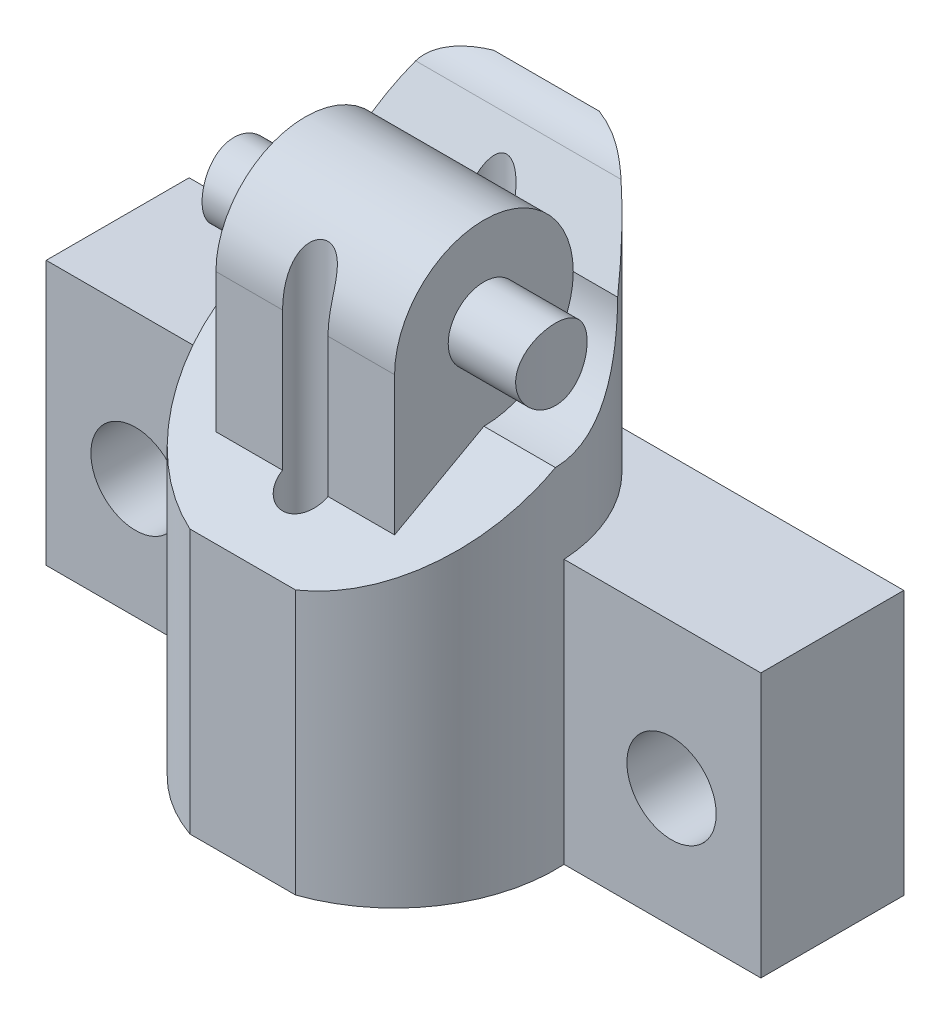
from build123d import *

# Parameters (mm, degrees)
BOSS_EXTRUDE1_DEPTH = 45
SKETCH2_R           = 1.27
CUT_EXTRUDE1_DEPTH  = 51.256
CUT_EXTRUDE2_REACH  = 50.939
SKETCH3_W           = 10
SKETCH3_H           = 10
SKETCH4_R           = 2.049999964
CUT_EXTRUDE3_DEPTH  = 17.5
CUT_EXTRUDE5_START  = -7.95804
SKETCH6_R           = 2
CUT_EXTRUDE5_DEPTH  = 9.6
FILLET3_R           = 1
CUT_EXTRUDE6_START  = 8.64596
SKETCH6_3_R         = 2
CUT_EXTRUDE6_DEPTH  = 6.604
CUT_EXTRUDE7_START  = -14.986
CUT_EXTRUDE7_DEPTH  = 14.986
SKETCH9_W           = 75.785705501
SKETCH9_H           = 55.117400044
CUT_EXTRUDE9_DEPTH  = 51.308
FILLET4_R           = 1
BOSS_EXTRUDE2_START = -9
SKETCH11_W          = 40
SKETCH11_H          = 14.788433541
SKETCH11_R          = 2.5
BOSS_EXTRUDE2_DEPTH = 8


with BuildPart() as part:
    # Sketch1 → Boss-Extrude1 (new body)
    with BuildSketch(Plane(origin=(0, 0, 0), x_dir=(1, 0, 0), z_dir=(0, 1, 0))):
        with BuildLine():
            Line((-2.958039892, 8.5), (2.958039892, 8.5))
            ThreePointArc((2.958039892, 8.5), (9, 0), (2.958039892, -8.5))
            Line((2.958039892, -8.5), (-2.958039892, -8.5))
            ThreePointArc((-2.958039892, -8.5), (-9, 0), (-2.958039892, 8.5))
        make_face()
    extrude(amount=BOSS_EXTRUDE1_DEPTH)

    # Sketch2 → Cut-Extrude1 (cut)
    with BuildSketch(Plane.XZ):
        with Locations(Location((0, -5, 0), (0, 0, 270))):
            Circle(SKETCH2_R)
        with Locations(Location((0, 5, 0), (0, 0, 270))):
            Circle(SKETCH2_R)
    extrude(amount=-CUT_EXTRUDE1_DEPTH, mode=Mode.SUBTRACT)

    # Cut-Extrude2: up to this face of the body (flat: up to its plane)
    cut_extrude2_end = Plane(part.part.faces().sort_by_distance((0, 22.5, 8.5))[0])
    # Sketch3 → Cut-Extrude2 (cut, up to the picked face)
    with BuildSketch(Plane(origin=(0, 0, -8.5), x_dir=(-1, 0, 0), z_dir=(0, 0, -1)), mode=Mode.PRIVATE) as cut_extrude2_sk1:
        with Locations((0, 5)):
            Rectangle(SKETCH3_W, SKETCH3_H)
    cut_extrude2_tool1 = split(extrude(cut_extrude2_sk1.sketch, amount=-CUT_EXTRUDE2_REACH, mode=Mode.PRIVATE), bisect_by=cut_extrude2_end, keep=Keep.BOTH, mode=Mode.PRIVATE)
    add(cut_extrude2_tool1.solids().sort_by(Axis((0, 5, -8.5), (0, 0, 1)))[0], mode=Mode.SUBTRACT)

    # Sketch4 → Cut-Extrude3 (cut, symmetric)
    with BuildSketch(Plane.ZY.offset(-5)):
        with Locations(Location((0, 5, 0), (0, 0, 270))):
            Circle(SKETCH4_R)
        with BuildLine():
            Line((-7.483314774, 10), (-5, 5))
            ThreePointArc((-5, 5), (0, 0), (5, 5))
            Line((5, 5), (8.5, 12.308552788))
            Line((8.5, 12.308552788), (9.857943437, -1.822240199))
            Line((9.857943437, -1.822240199), (-9.857943437, -1.822240199))
            Line((-9.857943437, -1.822240199), (-7.483314774, 10))
        make_face()
    extrude(amount=CUT_EXTRUDE3_DEPTH, both=True, mode=Mode.SUBTRACT)

    # Sketch6 → Cut-Extrude5 (cut)
    with BuildSketch(Plane.ZY.offset(2.958039892).offset(CUT_EXTRUDE5_START)):
        with BuildLine():
            Line((8.5, 30.295597565), (0, 35))
            ThreePointArc((0, 35), (-3.535533906, 36.464466094), (-5, 40))
            Line((-5, 40), (-6.925993812, 43.877868872))
            ThreePointArc((-6.925993812, 43.877868872), (-7.572574331, 44.635904287), (-8.5, 45))
            Line((-8.5, 45), (18.346383487, 50.62633631))
            Line((18.346383487, 50.62633631), (8.5, 30.295597565))
        make_face()
        with Locations((0, 40)):
            Circle(SKETCH6_R, mode=Mode.SUBTRACT)
    extrude(amount=-CUT_EXTRUDE5_DEPTH, mode=Mode.SUBTRACT)

    # Fillet3
    fillet3_edges = [part.edges().sort_by_distance(p)[0] for p in [
        (0, 10, -3.73),
        (0, 10, 6.27),
    ]]
    fillet(fillet3_edges, radius=FILLET3_R)

    # Sketch6<3> → Cut-Extrude6 (cut)
    with BuildSketch(Plane.ZY.offset(2.958039892).offset(CUT_EXTRUDE6_START)):
        with BuildLine():
            Line((8.5, 30.295597565), (0, 35))
            ThreePointArc((0, 35), (-3.535533906, 36.464466094), (-5, 40))
            Line((-5, 40), (-6.925993812, 43.877868872))
            ThreePointArc((-6.925993812, 43.877868872), (-7.572574331, 44.635904287), (-8.5, 45))
            Line((-8.5, 45), (18.346383487, 50.62633631))
            Line((18.346383487, 50.62633631), (8.5, 30.295597565))
        make_face()
        with Locations((0, 40)):
            Circle(SKETCH6_3_R, mode=Mode.SUBTRACT)
    extrude(amount=-CUT_EXTRUDE6_DEPTH, mode=Mode.SUBTRACT)

    # Sketch7 → Cut-Extrude7 (cut)
    with BuildSketch(Plane(origin=(5, 0, 0), x_dir=(0, 0, -1), z_dir=(1, 0, 0)).offset(CUT_EXTRUDE7_START)):
        with BuildLine():
            Line((-5, 40), (-5, 32.23270445))
            Line((-5, 32.23270445), (-8.5, 30.295597565))
            Line((-8.5, 30.295597565), (-10.643597919, 58.76944937))
            Line((-10.643597919, 58.76944937), (18.960626954, 55.630212042))
            Line((18.960626954, 55.630212042), (8.5, 45))
            ThreePointArc((8.5, 45), (7.572574331, 44.635904287), (6.925993812, 43.877868872))
            Line((6.925993812, 43.877868872), (5, 40))
            ThreePointArc((5, 40), (0, 45), (-5, 40))
        make_face()
    extrude(amount=CUT_EXTRUDE7_DEPTH, mode=Mode.SUBTRACT)

    # Sketch9 → Cut-Extrude9 (cut)
    with BuildSketch(Plane.XY.offset(8.5)):
        with Locations((-12.772136987, -12.051535998)):
            Rectangle(SKETCH9_W, SKETCH9_H)
    extrude(amount=-CUT_EXTRUDE9_DEPTH, mode=Mode.SUBTRACT)

    # Fillet4
    fillet4_edges = [part.edges().sort_by_distance(p)[0] for p in [
        (0, 15.507164024, -3.73),
        (0, 15.507164024, 6.27),
    ]]
    fillet(fillet4_edges, radius=FILLET4_R)

    # Sketch11 → Boss-Extrude2 (add)
    with BuildSketch(Plane.XY.offset(8.5).offset(BOSS_EXTRUDE2_START)):
        with Locations((0, 22.901380794)):
            Rectangle(SKETCH11_W, SKETCH11_H)
        with Locations((15, 22.201664168)):
            Circle(SKETCH11_R, mode=Mode.SUBTRACT)
        with Locations((-15, 22.201664168)):
            Circle(SKETCH11_R, mode=Mode.SUBTRACT)
    extrude(amount=-BOSS_EXTRUDE2_DEPTH)


solid = part.part
